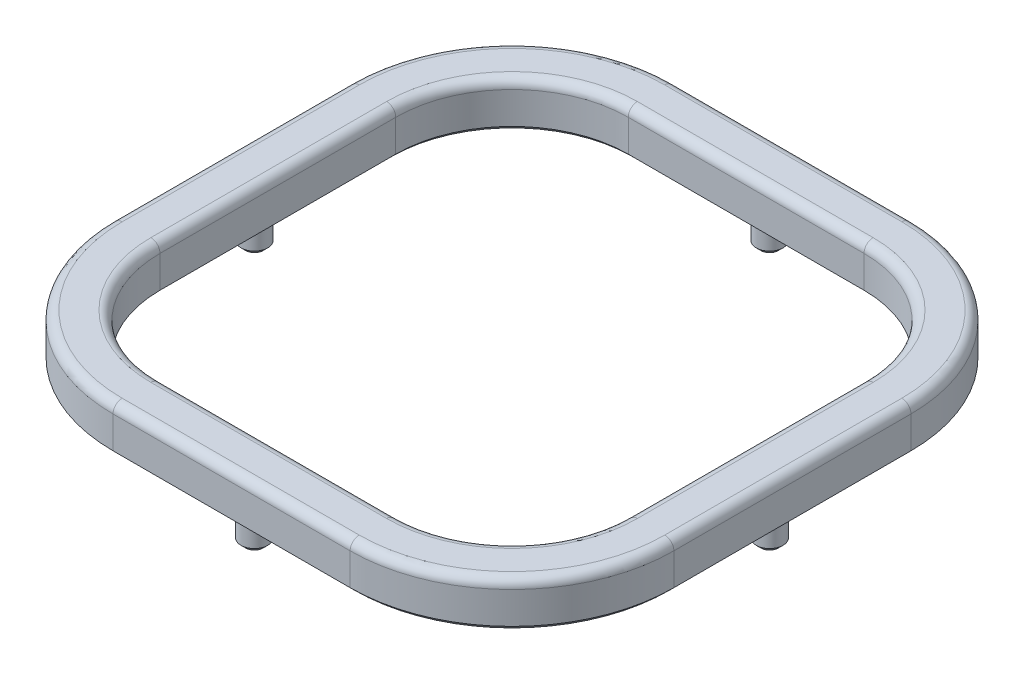
from build123d import *

# Parameters (mm, degrees)
EXTRUDE_1_DEPTH = 10
SKETCH_1_7_R    = 2.925
EXTRUDE_2_DEPTH = 6
CHAMFER_1_SIZE  = 1
FILLET_1_R      = 2
FILLET_2_R      = 0.4


with BuildPart() as part:
    # Эскиз1 → Бобышка-Вытянуть1 (new body)
    with BuildSketch(Plane(origin=(0, 0, 0), x_dir=(1, 0, 0), z_dir=(0, 1, 0))):
        with BuildLine():
            Line((26, -61.5), (-26, -61.5))
            ThreePointArc((-26, -61.5), (-51.102290732, -51.102290732), (-61.5, -26))
            Line((-61.5, -26), (-61.5, 26))
            ThreePointArc((-61.5, 26), (-51.102290732, 51.102290732), (-26, 61.5))
            Line((-26, 61.5), (26, 61.5))
            ThreePointArc((26, 61.5), (51.102290732, 51.102290732), (61.5, 26))
            Line((61.5, 26), (61.5, -26))
            ThreePointArc((61.5, -26), (51.102290732, -51.102290732), (26, -61.5))
        make_face()
        with BuildLine():
            Line((25.85, -51.35), (-25.85, -51.35))
            ThreePointArc((-25.85, -51.35), (-43.88122292, -43.88122292), (-51.35, -25.85))
            Line((-51.35, -25.85), (-51.35, 25.85))
            ThreePointArc((-51.35, 25.85), (-43.88122292, 43.88122292), (-25.85, 51.35))
            Line((-25.85, 51.35), (25.85, 51.35))
            ThreePointArc((25.85, 51.35), (43.88122292, 43.88122292), (51.35, 25.85))
            Line((51.35, 25.85), (51.35, -25.85))
            ThreePointArc((51.35, -25.85), (43.88122292, -43.88122292), (25.85, -51.35))
        make_face(mode=Mode.SUBTRACT)
    extrude(amount=EXTRUDE_1_DEPTH)

    # Эскиз1<7> → Бобышка-Вытянуть2 (add)
    with BuildSketch(Plane(origin=(0, 0, 0), x_dir=(1, 0, 0), z_dir=(0, 1, 0))):
        with Locations((0, 56.5)):
            Circle(SKETCH_1_7_R)
        with Locations((-56.5, 0)):
            Circle(SKETCH_1_7_R)
        with Locations((0, -56.5)):
            Circle(SKETCH_1_7_R)
        with Locations((56.5, 0)):
            Circle(SKETCH_1_7_R)
    extrude(amount=-EXTRUDE_2_DEPTH)

    # Фаска1
    chamfer_1_edges = [part.edges().sort_by_distance(p)[0] for p in [
        (53.575, -6, 0),
        (-2.925, -6, -56.5),
        (-59.425, -6, 0),
        (-2.925, -6, 56.5),
        (43.88122292, 0, -43.88122292),
        (0, 0, -51.35),
        (51.35, 0, 0),
        (-43.88122292, 0, -43.88122292),
        (43.88122292, 0, 43.88122292),
        (-51.35, 0, 0),
        (0, 0, 51.35),
        (-43.88122292, 0, 43.88122292),
        (0, 0, -61.5),
        (51.102290732, 0, -51.102290732),
        (-51.102290732, 0, -51.102290732),
        (61.5, 0, 0),
        (-61.5, 0, 0),
        (51.102290732, 0, 51.102290732),
        (-51.102290732, 0, 51.102290732),
        (0, 0, 61.5),
    ]]
    chamfer(chamfer_1_edges, length=CHAMFER_1_SIZE)

    # Скругление1
    fillet_1_edges = [part.edges().sort_by_distance(p)[0] for p in [
        (-51.35, 10, 0),
        (-43.88122292, 10, -43.88122292),
        (0, 10, -51.35),
        (43.88122292, 10, -43.88122292),
        (51.35, 10, 0),
        (43.88122292, 10, 43.88122292),
        (0, 10, 51.35),
        (51.102290732, 10, 51.102290732),
        (61.5, 10, 0),
        (51.102290732, 10, -51.102290732),
        (0, 10, -61.5),
        (-51.102290732, 10, -51.102290732),
        (-61.5, 10, 0),
        (-51.102290732, 10, 51.102290732),
        (-43.88122292, 10, 43.88122292),
        (0, 10, 61.5),
    ]]
    fillet(fillet_1_edges, radius=FILLET_1_R)

    # Скругление2
    fillet_2_edges = [part.edges().sort_by_distance(p)[0] for p in [
        (-2.925, 0, -56.5),
        (-2.925, 0, 56.5),
        (-59.425, 0, 0),
        (53.575, 0, 0),
    ]]
    fillet(fillet_2_edges, radius=FILLET_2_R)


solid = part.part
